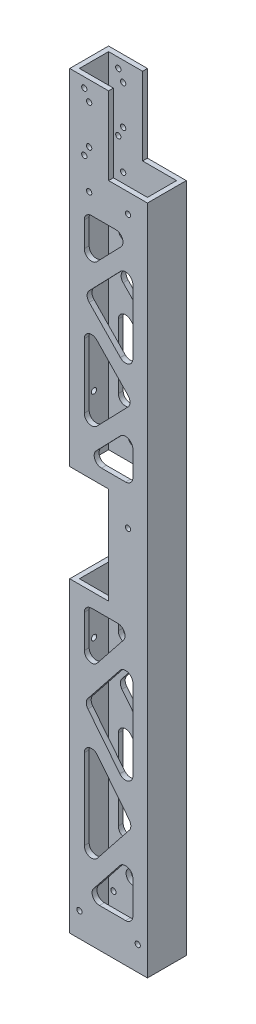
from build123d import *

# Parameters (mm, degrees)
SKETCH1_W                 = 50.8
SKETCH1_H                 = 25.4
SKETCH1_W_2               = 44.45
SKETCH1_H_2               = 19.05
BOSS_EXTRUDE1_DEPTH       = 244.7925
SKETCH2_W                 = 25.4
SKETCH2_H                 = 50.8
CUT_EXTRUDE1_DEPTH        = 248.414001334
SKETCH3_W                 = 25.4
SKETCH3_H                 = 63.5
CUT_EXTRUDE2_DEPTH        = 248.414001334
F_8_32_TAPPED_HOLE1_D     = 3.4544
F_8_32_TAPPED_HOLE2_D     = 3.4544
CUT_EXTRUDE3_DEPTH        = 248.414001334
FILLET1_R                 = 4.7625
F_8_32_TAPPED_HOLE3_D     = 3.4544
F_8_32_TAPPED_HOLE4_D     = 3.4544
F_8_32_TAPPED_HOLE4_DEPTH = 3.175
F_8_32_TAPPED_HOLE5_D     = 3.4544


with BuildPart() as part:
    # Sketch1 → Boss-Extrude1 (new, symmetric)
    with BuildSketch(Plane(origin=(0, 0, 0), x_dir=(1, 0, 0), z_dir=(0, 1, 0))):
        Rectangle(SKETCH1_W, SKETCH1_H)
        Rectangle(SKETCH1_W_2, SKETCH1_H_2, mode=Mode.SUBTRACT)
    extrude(amount=BOSS_EXTRUDE1_DEPTH, both=True)

    # Sketch2 → Cut-Extrude1 (cut, through all)
    with BuildSketch(Plane.XY.offset(12.7)):
        with Locations((12.7, 219.3925)):
            Rectangle(SKETCH2_W, SKETCH2_H)
    extrude(amount=-CUT_EXTRUDE1_DEPTH, mode=Mode.SUBTRACT)

    # Sketch3 → Cut-Extrude2 (cut, through all)
    with BuildSketch(Plane.XY.offset(12.7)):
        with Locations((-12.7, -12.3825)):
            Rectangle(SKETCH3_W, SKETCH3_H)
    extrude(amount=-CUT_EXTRUDE2_DEPTH, mode=Mode.SUBTRACT)

    # #8-32 Tapped Hole1 (through all)
    with Locations(Plane(origin=(0, 0, -12.7), x_dir=(-1, 0, 0), z_dir=(0, 0, -1))):
        with Locations((12.7, 232.0925), (12.7, 206.6925), (12.7, 181.2925), (-12.7, 181.2925)):
            Hole(F_8_32_TAPPED_HOLE1_D / 2)

    # #8-32 Tapped Hole2 (through all)
    with Locations(Plane.XY.offset(12.7)):
        with Locations((-15.875, 238.4425), (-15.875, 200.3425)):
            Hole(F_8_32_TAPPED_HOLE2_D / 2)

    # Sketch8 → Cut-Extrude3 (cut, through all)
    with BuildSketch(Plane.XY.offset(12.7)):
        Polygon((15.875, -219.3925), (15.875, -179.453847181), (-15.875, -219.3925), align=None)
        Polygon((-15.875, -204.086152819), (15.875, -164.1475), (-15.875, -124.208847181), align=None)
        Polygon((-15.875, -108.9025), (15.875, -148.841152819), (15.875, -68.963847181), align=None)
        Polygon((-15.875, -93.596152819), (15.875, -53.6575), (-15.875, -53.6575), align=None)
        Polygon((-15.875, 28.8925), (15.875, 28.8925), (15.875, 61.751507535), align=None)
        Polygon((-15.875, 42.600159131), (15.875, 75.459166667), (-15.875, 108.318174202), align=None)
        Polygon((-15.875, 122.025833333), (15.875, 89.166825798), (15.875, 154.884840869), align=None)
        Polygon((-15.875, 168.5925), (-15.875, 135.733492465), (15.875, 168.5925), align=None)
    extrude(amount=-CUT_EXTRUDE3_DEPTH, mode=Mode.SUBTRACT)

    # Fillet1
    fillet1_edges = [part.edges().sort_by_distance(p)[0] for p in [
        (-15.875, -204.086152819, -11.1125),
        (-15.875, -124.208847181, -11.1125),
        (15.875, -164.1475, -11.1125),
        (-15.875, -204.086152819, 11.1125),
        (-15.875, -124.208847181, 11.1125),
        (15.875, -164.1475, 11.1125),
        (15.875, -148.841152819, -11.1125),
        (-15.875, -108.9025, -11.1125),
        (15.875, -68.963847181, -11.1125),
        (15.875, -148.841152819, 11.1125),
        (-15.875, -108.9025, 11.1125),
        (15.875, -68.963847181, 11.1125),
        (-15.875, -93.596152819, -11.1125),
        (-15.875, -53.6575, -11.1125),
        (15.875, -53.6575, -11.1125),
        (-15.875, -93.596152819, 11.1125),
        (-15.875, -53.6575, 11.1125),
        (15.875, -53.6575, 11.1125),
        (15.875, 61.751507535, -11.1125),
        (15.875, 28.8925, -11.1125),
        (-15.875, 28.8925, -11.1125),
        (15.875, 61.751507535, 11.1125),
        (15.875, 28.8925, 11.1125),
        (-15.875, 28.8925, 11.1125),
        (-15.875, 42.600159131, -11.1125),
        (-15.875, 108.318174202, -11.1125),
        (15.875, 75.459166667, -11.1125),
        (-15.875, 42.600159131, 11.1125),
        (-15.875, 108.318174202, 11.1125),
        (15.875, 75.459166667, 11.1125),
        (15.875, 89.166825798, -11.1125),
        (-15.875, 122.025833333, -11.1125),
        (15.875, 154.884840869, -11.1125),
        (15.875, 89.166825798, 11.1125),
        (-15.875, 122.025833333, 11.1125),
        (15.875, 154.884840869, 11.1125),
        (-15.875, 135.733492465, -11.1125),
        (-15.875, 168.5925, -11.1125),
        (15.875, 168.5925, -11.1125),
        (-15.875, 135.733492465, 11.1125),
        (-15.875, 168.5925, 11.1125),
        (15.875, 168.5925, 11.1125),
        (-15.875, -219.3925, -11.1125),
        (15.875, -179.453847181, -11.1125),
        (15.875, -219.3925, -11.1125),
        (-15.875, -219.3925, 11.1125),
        (15.875, -179.453847181, 11.1125),
        (15.875, -219.3925, 11.1125),
    ]]
    fillet(fillet1_edges, radius=FILLET1_R)

    # #8-32 Tapped Hole3 (through all)
    with Locations(Plane.XY.offset(12.7)):
        with Locations((12.7, 3.4925)):
            Hole(F_8_32_TAPPED_HOLE3_D / 2)

    # #8-32 Tapped Hole4
    with Locations(Plane.ZY.offset(25.4)):
        with Locations((0, 32.0675), (0, 57.4675), (0, -56.8325), (0, -82.2325)):
            Hole(F_8_32_TAPPED_HOLE4_D / 2, depth=F_8_32_TAPPED_HOLE4_DEPTH)

    # #8-32 Tapped Hole5 (through all)
    with Locations(Plane.XY.offset(12.7)):
        with Locations((-19.05, -228.9175), (19.05, -228.9175)):
            Hole(F_8_32_TAPPED_HOLE5_D / 2)


solid = part.part
